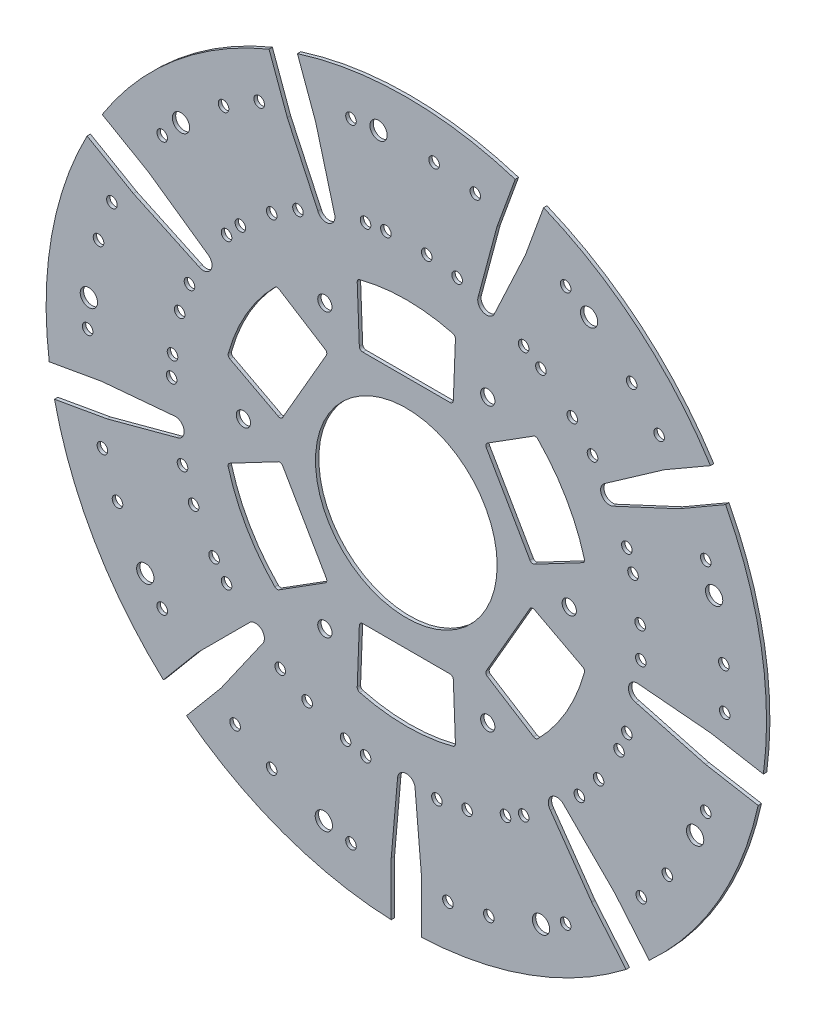
from build123d import *

# Parameters (mm, degrees)
ESBO_O1_R                = 214.5
ESBO_O1_R_2              = 54.1
RESSALTO_EXTRUS_O1_DEPTH = 2
CORTE_EXTRUS_O1_DEPTH    = 2
ESBO_O3_R                = 3.15
ESBO_O3_R_2              = 5.15
CORTE_EXTRUS_O2_DEPTH    = 2
CORTE_EXTRUS_O3_DEPTH    = 2
ESBO_O5_R                = 4.25
CORTE_EXTRUS_O4_DEPTH    = 2
FILETE1_R                = 2


with BuildPart() as part:
    # Esboço1 → Ressalto-extrusão1 (new body)
    with BuildSketch(Plane.XY):
        Circle(ESBO_O1_R)
        Circle(ESBO_O1_R_2, mode=Mode.SUBTRACT)
    extrude(amount=RESSALTO_EXTRUS_O1_DEPTH)

    # Esboço2 → Corte-extrusão1 (cut)
    with BuildSketch(Plane.XY.offset(2)):
        with BuildLine():
            Line((64.906087156, 204.642248449), (53.96144257, 174.572084583))
            Line((53.96144257, 174.572084583), (42.829022163, 133.025326012))
            ThreePointArc((42.829022163, 133.025326012), (45.96753481, 126.294763919), (52.698096903, 129.433276567))
            Line((52.698096903, 129.433276567), (70.875909744, 168.415722003))
            Line((70.875909744, 168.415722003), (81.82055433, 198.485885869))
            Line((81.82055433, 198.485885869), (64.906087156, 204.642248449))
        make_face()
        with BuildLine():
            Line((181.262449112, 115.044228634), (153.549636191, 99.044228634))
            Line((153.549636191, 99.044228634), (118.315965767, 74.373347005))
            ThreePointArc((118.315965767, 74.373347005), (116.393884021, 67.200040271), (123.567190754, 65.277958525))
            Line((123.567190754, 65.277958525), (162.549636191, 83.455771366))
            Line((162.549636191, 83.455771366), (190.262449112, 99.455771366))
            Line((190.262449112, 99.455771366), (181.262449112, 115.044228634))
        make_face()
        with BuildLine():
            Line((212.80409662, -28.384264332), (181.290248524, -22.827522647))
            Line((181.290248524, -22.827522647), (138.441554053, -19.078747634))
            ThreePointArc((138.441554053, -19.078747634), (132.358241324, -23.338329065), (136.617822754, -29.421641794))
            Line((136.617822754, -29.421641794), (178.164581326, -40.554062201))
            Line((178.164581326, -40.554062201), (209.678429422, -46.110803887))
            Line((209.678429422, -46.110803887), (212.80409662, -28.384264332))
        make_face()
        with BuildLine():
            Line((144.772342266, -158.531444562), (124.203138756, -134.018022382))
            Line((124.203138756, -134.018022382), (93.788800592, -103.603684218))
            ThreePointArc((93.788800592, -103.603684218), (86.390706514, -102.956434854), (85.74345715, -110.354528933))
            Line((85.74345715, -110.354528933), (110.41433878, -145.588199356))
            Line((110.41433878, -145.588199356), (130.98354229, -170.101621536))
            Line((130.98354229, -170.101621536), (144.772342266, -158.531444562))
        make_face()
        with BuildLine():
            Line((9, -214.5), (9, -182.5))
            Line((9, -182.5), (5.251224987, -139.65130553))
            ThreePointArc((5.251224987, -139.65130553), (0, -134.400080543), (-5.251224987, -139.65130553))
            Line((-5.251224987, -139.65130553), (-9, -182.5))
            Line((-9, -182.5), (-9, -214.5))
            Line((-9, -214.5), (9, -214.5))
        make_face()
        with BuildLine():
            Line((-130.98354229, -170.101621536), (-110.41433878, -145.588199356))
            Line((-110.41433878, -145.588199356), (-85.74345715, -110.354528933))
            ThreePointArc((-85.74345715, -110.354528933), (-86.390706514, -102.956434854), (-93.788800592, -103.603684218))
            Line((-93.788800592, -103.603684218), (-124.203138756, -134.018022382))
            Line((-124.203138756, -134.018022382), (-144.772342266, -158.531444562))
            Line((-144.772342266, -158.531444562), (-130.98354229, -170.101621536))
        make_face()
        with BuildLine():
            Line((-209.678429422, -46.110803887), (-178.164581326, -40.554062201))
            Line((-178.164581326, -40.554062201), (-136.617822754, -29.421641794))
            ThreePointArc((-136.617822754, -29.421641794), (-132.358241324, -23.338329065), (-138.441554053, -19.078747634))
            Line((-138.441554053, -19.078747634), (-181.290248524, -22.827522647))
            Line((-181.290248524, -22.827522647), (-212.80409662, -28.384264332))
            Line((-212.80409662, -28.384264332), (-209.678429422, -46.110803887))
        make_face()
        with BuildLine():
            Line((-190.262449112, 99.455771366), (-162.549636191, 83.455771366))
            Line((-162.549636191, 83.455771366), (-123.567190754, 65.277958525))
            ThreePointArc((-123.567190754, 65.277958525), (-116.393884021, 67.200040271), (-118.315965767, 74.373347005))
            Line((-118.315965767, 74.373347005), (-153.549636191, 99.044228634))
            Line((-153.549636191, 99.044228634), (-181.262449112, 115.044228634))
            Line((-181.262449112, 115.044228634), (-190.262449112, 99.455771366))
        make_face()
        with BuildLine():
            Line((-81.82055433, 198.485885869), (-70.875909744, 168.415722003))
            Line((-70.875909744, 168.415722003), (-52.698096903, 129.433276567))
            ThreePointArc((-52.698096903, 129.433276567), (-45.96753481, 126.294763919), (-42.829022163, 133.025326012))
            Line((-42.829022163, 133.025326012), (-53.96144257, 174.572084583))
            Line((-53.96144257, 174.572084583), (-64.906087156, 204.642248449))
            Line((-64.906087156, 204.642248449), (-81.82055433, 198.485885869))
        make_face()
    extrude(amount=-CORTE_EXTRUS_O1_DEPTH, mode=Mode.SUBTRACT)

    # Esboço3 → Corte-extrusão2 (cut)
    with BuildSketch(Plane.XY.offset(2)):
        with Locations((-32.949741712, 186.867271134)):
            Circle(ESBO_O3_R)
        with Locations((-16.537802186, 189.027943963)):
            Circle(ESBO_O3_R_2)
        with Locations((16.537802186, 189.027943963)):
            Circle(ESBO_O3_R)
        with Locations((41.069416745, 185.252167351)):
            Circle(ESBO_O3_R)
        with Locations((30.247436048, 136.437366995)):
            Circle(ESBO_O3_R)
        with Locations((12.180015049, 139.218209058)):
            Circle(ESBO_O3_R)
        with Locations((-12.180015049, 139.218209058)):
            Circle(ESBO_O3_R)
        with Locations((-24.267332829, 137.626883483)):
            Circle(ESBO_O3_R)
        with Locations((94.875, 164.328320368)):
            Circle(ESBO_O3_R)
        with Locations((108.836128798, 155.434100404)):
            Circle(ESBO_O3_R_2)
        with Locations((134.17351173, 134.17351173)):
            Circle(ESBO_O3_R)
        with Locations((150.53879632, 115.512481154)):
            Circle(ESBO_O3_R)
        with Locations((110.871129306, 85.074409704)):
            Circle(ESBO_O3_R)
        with Locations((98.818172671, 98.818172671)):
            Circle(ESBO_O3_R)
        with Locations((80.15730698, 114.476498189)):
            Circle(ESBO_O3_R)
        with Locations((69.875, 121.027050179)):
            Circle(ESBO_O3_R)
        with Locations((178.306674794, 64.898322196)):
            Circle(ESBO_O3_R)
        with Locations((183.284425538, 49.110913808)):
            Circle(ESBO_O3_R_2)
        with Locations((189.027943963, 16.537802186)):
            Circle(ESBO_O3_R)
        with Locations((189.569400045, -8.276778753)):
            Circle(ESBO_O3_R)
        with Locations((139.616988966, -6.095809384)):
            Circle(ESBO_O3_R)
        with Locations((139.218209058, 12.180015049)):
            Circle(ESBO_O3_R)
        with Locations((134.988134224, 36.169961553)):
            Circle(ESBO_O3_R)
        with Locations((131.322043755, 47.79731503)):
            Circle(ESBO_O3_R)
        with Locations((178.306674794, -64.898322196)):
            Circle(ESBO_O3_R)
        with Locations((171.97190259, -80.191815165)):
            Circle(ESBO_O3_R_2)
        with Locations((155.434100404, -108.836128798)):
            Circle(ESBO_O3_R)
        with Locations((139.89837466, -128.193241895)):
            Circle(ESBO_O3_R)
        with Locations((103.034507819, -94.413731514)):
            Circle(ESBO_O3_R)
        with Locations((114.476498189, -80.15730698)):
            Circle(ESBO_O3_R)
        with Locations((126.656513238, -59.060902078)):
            Circle(ESBO_O3_R)
        with Locations((131.322043755, -47.79731503)):
            Circle(ESBO_O3_R)
        with Locations((94.875, -164.328320368)):
            Circle(ESBO_O3_R)
        with Locations((80.191815165, -171.97190259)):
            Circle(ESBO_O3_R_2)
        with Locations((49.110913808, -183.284425538)):
            Circle(ESBO_O3_R)
        with Locations((24.767344974, -188.126662446)):
            Circle(ESBO_O3_R)
        with Locations((18.241035363, -138.554419377)):
            Circle(ESBO_O3_R)
        with Locations((36.169961553, -134.988134224)):
            Circle(ESBO_O3_R)
        with Locations((59.060902078, -126.656513238)):
            Circle(ESBO_O3_R)
        with Locations((69.875, -121.027050179)):
            Circle(ESBO_O3_R)
        with Locations((-32.949741712, -186.867271134)):
            Circle(ESBO_O3_R)
        with Locations((-49.110913808, -183.284425538)):
            Circle(ESBO_O3_R_2)
        with Locations((-80.191815165, -171.97190259)):
            Circle(ESBO_O3_R)
        with Locations((-101.952600684, -160.033526843)):
            Circle(ESBO_O3_R)
        with Locations((-75.087620266, -117.863954552)):
            Circle(ESBO_O3_R)
        with Locations((-59.060902078, -126.656513238)):
            Circle(ESBO_O3_R)
        with Locations((-36.169961553, -134.988134224)):
            Circle(ESBO_O3_R)
        with Locations((-24.267332829, -137.626883483)):
            Circle(ESBO_O3_R)
        with Locations((-145.356933082, -121.968948938)):
            Circle(ESBO_O3_R)
        with Locations((-155.434100404, -108.836128798)):
            Circle(ESBO_O3_R_2)
        with Locations((-171.97190259, -80.191815165)):
            Circle(ESBO_O3_R)
        with Locations((-180.967791404, -57.058925456)):
            Circle(ESBO_O3_R)
        with Locations((-133.281943867, -42.023635481)):
            Circle(ESBO_O3_R)
        with Locations((-126.656513238, -59.060902078)):
            Circle(ESBO_O3_R)
        with Locations((-114.476498189, -80.15730698)):
            Circle(ESBO_O3_R)
        with Locations((-107.054710926, -89.829568454)):
            Circle(ESBO_O3_R)
        with Locations((-189.75, 0)):
            Circle(ESBO_O3_R)
        with Locations((-189.027943963, 16.537802186)):
            Circle(ESBO_O3_R_2)
        with Locations((-183.284425538, 49.110913808)):
            Circle(ESBO_O3_R)
        with Locations((-175.306141294, 72.614181291)):
            Circle(ESBO_O3_R)
        with Locations((-129.112164668, 53.480009673)):
            Circle(ESBO_O3_R)
        with Locations((-134.988134224, 36.169961553)):
            Circle(ESBO_O3_R)
        with Locations((-139.218209058, 12.180015049)):
            Circle(ESBO_O3_R)
        with Locations((-139.75, 0)):
            Circle(ESBO_O3_R)
        with Locations((-145.356933082, 121.968948938)):
            Circle(ESBO_O3_R)
        with Locations((-134.17351173, 134.17351173)):
            Circle(ESBO_O3_R_2)
        with Locations((-108.836128798, 155.434100404)):
            Circle(ESBO_O3_R)
        with Locations((-87.616799361, 168.310305596)):
            Circle(ESBO_O3_R)
        with Locations((-64.5293687, 123.959763937)):
            Circle(ESBO_O3_R)
        with Locations((-80.15730698, 114.476498189)):
            Circle(ESBO_O3_R)
        with Locations((-98.818172671, 98.818172671)):
            Circle(ESBO_O3_R)
        with Locations((-107.054710926, 89.829568454)):
            Circle(ESBO_O3_R)
    extrude(amount=-CORTE_EXTRUS_O2_DEPTH, mode=Mode.SUBTRACT)

    # Esboço4 → Corte-extrusão3 (cut)
    with BuildSketch(Plane.XY.offset(2)):
        with BuildLine():
            Line((-27.91, 70), (27.91, 70))
            Line((27.91, 70), (29.305, 106.024605517))
            ThreePointArc((29.305, 106.024605517), (0, 110), (-29.305, 106.024605517))
            Line((-29.305, 106.024605517), (-27.91, 70))
        make_face()
        with BuildLine():
            Line((46.666778265, 59.17076902), (74.576778265, 10.82923098))
            Line((74.576778265, 10.82923098), (106.472501804, 27.633428301))
            ThreePointArc((106.472501804, 27.633428301), (95.262794416, 55), (77.167501804, 78.391177216))
            Line((77.167501804, 78.391177216), (46.666778265, 59.17076902))
        make_face()
        with BuildLine():
            Line((74.576778265, -10.82923098), (46.666778265, -59.17076902))
            Line((46.666778265, -59.17076902), (77.167501804, -78.391177216))
            ThreePointArc((77.167501804, -78.391177216), (95.262794416, -55), (106.472501804, -27.633428301))
            Line((106.472501804, -27.633428301), (74.576778265, -10.82923098))
        make_face()
        with BuildLine():
            Line((27.91, -70), (-27.91, -70))
            Line((-27.91, -70), (-29.305, -106.024605517))
            ThreePointArc((-29.305, -106.024605517), (0, -110), (29.305, -106.024605517))
            Line((29.305, -106.024605517), (27.91, -70))
        make_face()
        with BuildLine():
            Line((-46.666778265, -59.17076902), (-74.576778265, -10.82923098))
            Line((-74.576778265, -10.82923098), (-106.472501804, -27.633428301))
            ThreePointArc((-106.472501804, -27.633428301), (-95.262794416, -55), (-77.167501804, -78.391177216))
            Line((-77.167501804, -78.391177216), (-46.666778265, -59.17076902))
        make_face()
        with BuildLine():
            Line((-74.576778265, 10.82923098), (-46.666778265, 59.17076902))
            Line((-46.666778265, 59.17076902), (-77.167501804, 78.391177216))
            ThreePointArc((-77.167501804, 78.391177216), (-95.262794416, 55), (-106.472501804, 27.633428301))
            Line((-106.472501804, 27.633428301), (-74.576778265, 10.82923098))
        make_face()
    extrude(amount=-CORTE_EXTRUS_O3_DEPTH, mode=Mode.SUBTRACT)

    # Esboço5 → Corte-extrusão4 (cut)
    with BuildSketch(Plane.XY.offset(2)):
        with Locations((48.5, 84.004464167)):
            Circle(ESBO_O5_R)
        with Locations((97, 0)):
            Circle(ESBO_O5_R)
        with Locations((48.5, -84.004464167)):
            Circle(ESBO_O5_R)
        with Locations((-48.5, -84.004464167)):
            Circle(ESBO_O5_R)
        with Locations((-97, 0)):
            Circle(ESBO_O5_R)
        with Locations((-48.5, 84.004464167)):
            Circle(ESBO_O5_R)
    extrude(amount=-CORTE_EXTRUS_O4_DEPTH, mode=Mode.SUBTRACT)

    # Filete1
    filete1_edges = [part.edges().sort_by_distance(p)[0] for p in [
        (-27.91, 70, 1),
        (-29.305, 106.024605517, 1),
        (29.305, 106.024605517, 1),
        (27.91, 70, 1),
        (46.666778265, 59.17076902, 1),
        (77.167501804, 78.391177216, 1),
        (106.472501804, 27.633428301, 1),
        (74.576778265, 10.82923098, 1),
        (74.576778265, -10.82923098, 1),
        (106.472501804, -27.633428301, 1),
        (77.167501804, -78.391177216, 1),
        (46.666778265, -59.17076902, 1),
        (27.91, -70, 1),
        (29.305, -106.024605517, 1),
        (-29.305, -106.024605517, 1),
        (-27.91, -70, 1),
        (-46.666778265, -59.17076902, 1),
        (-77.167501804, -78.391177216, 1),
        (-106.472501804, -27.633428301, 1),
        (-74.576778265, -10.82923098, 1),
        (-74.576778265, 10.82923098, 1),
        (-106.472501804, 27.633428301, 1),
        (-77.167501804, 78.391177216, 1),
        (-46.666778265, 59.17076902, 1),
    ]]
    fillet(filete1_edges, radius=FILETE1_R)


solid = part.part
